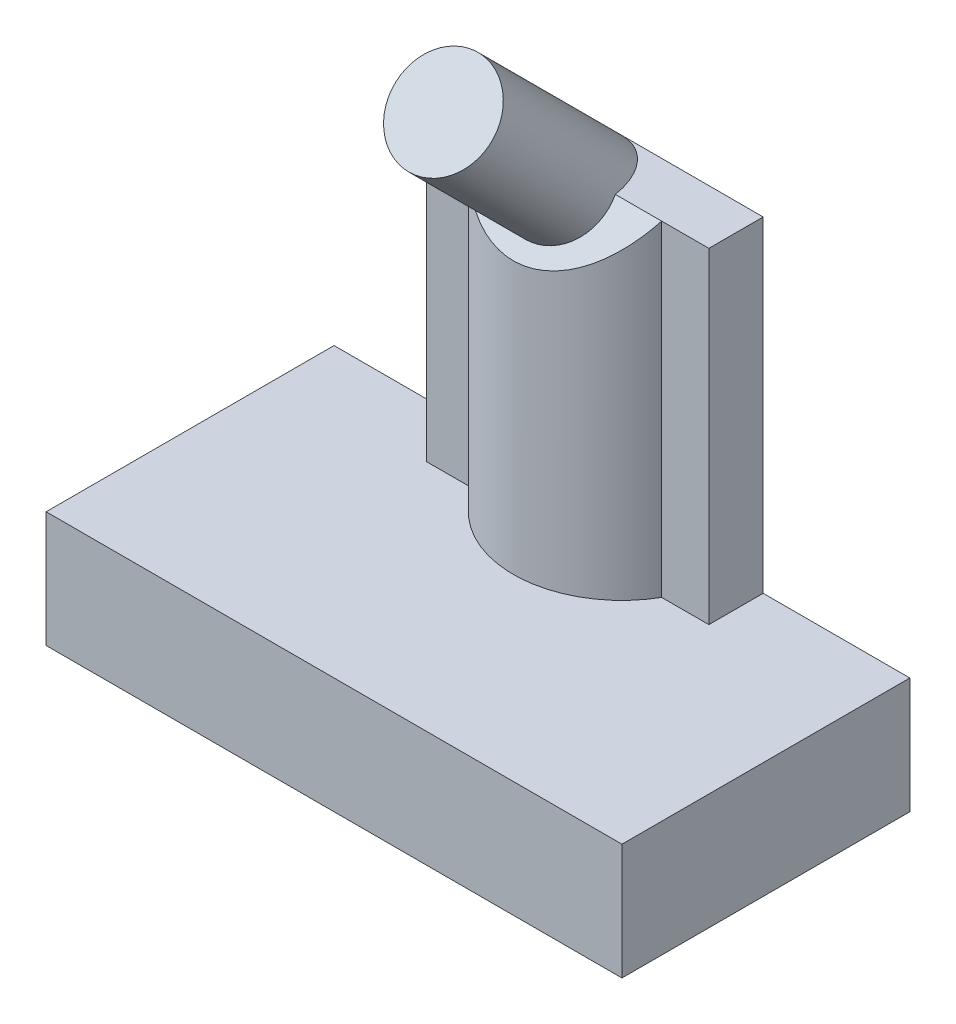
from build123d import *

# Parameters (mm, degrees)
SKETCH1_W           = 15.9
SKETCH1_H           = 7.95
BOSS_EXTRUDE1_DEPTH = 3.2
SHELL1_T            = -1.2
SKETCH3_R           = 1.525
SKETCH3_R_2         = 0.5
BOSS_EXTRUDE3_DEPTH = 2
BOSS_EXTRUDE4_DEPTH = 9
SKETCH7_W           = 30
SKETCH7_H           = 30
CUT_EXTRUDE1_DEPTH  = 14.969416324
BOSS_EXTRUDE5_START = -5.621499
SKETCH8_R           = 1.35
BOSS_EXTRUDE5_DEPTH = 5.621499


with BuildPart() as part:
    # Sketch1 → Boss-Extrude1 (new body)
    with BuildSketch(Plane(origin=(0, 0, 0), x_dir=(1, 0, 0), z_dir=(0, 1, 0))):
        Rectangle(SKETCH1_W, SKETCH1_H)
    extrude(amount=BOSS_EXTRUDE1_DEPTH)

    # Shell1
    shell1_openings = [part.faces().sort_by_distance(p)[0] for p in [
        (0, 0, 0),
    ]]
    offset(amount=SHELL1_T, openings=shell1_openings, kind=Kind.INTERSECTION)

    # Sketch3 → Boss-Extrude3 (add)
    with BuildSketch(Plane.XZ.offset(-2)):
        with Locations(Location((0, 0, 0), (0, 0, 270))):
            Circle(SKETCH3_R)
        with Locations(Location((0, 0, 0), (0, 0, 270))):
            Circle(SKETCH3_R_2, mode=Mode.SUBTRACT)
    extrude(amount=BOSS_EXTRUDE3_DEPTH)

    # Sketch4 → Boss-Extrude4 (add)
    with BuildSketch(Plane(origin=(0, 3.2, 0), x_dir=(1, 0, 0), z_dir=(0, 1, 0))):
        with BuildLine():
            Line((-3.9, 3.975), (-3.9, 2.475))
            Line((-3.9, 2.475), (-2.598076211, 2.475))
            ThreePointArc((-2.598076211, 2.475), (0, 0.975), (2.598076211, 2.475))
            Line((2.598076211, 2.475), (3.9, 2.475))
            Line((3.9, 2.475), (3.9, 3.975))
            Line((3.9, 3.975), (-3.9, 3.975))
        make_face()
    extrude(amount=BOSS_EXTRUDE4_DEPTH)

    # Sketch7 → Cut-Extrude1 (cut, through all)
    with BuildSketch(Plane(origin=(0, 4.863093078, 4.863093078), x_dir=(1, 0, 0), z_dir=(0, 0.7071067811865475, 0.7071067811865477))):
        Rectangle(SKETCH7_W, SKETCH7_H)
    extrude(amount=CUT_EXTRUDE1_DEPTH, mode=Mode.SUBTRACT)

    # Sketch8 → Boss-Extrude5 (add)
    with BuildSketch(Plane(origin=(0, 8.0875, 8.0875), x_dir=(1, 0, 0), z_dir=(0, 0.7071067811865475, 0.7071067811865477)).offset(BOSS_EXTRUDE5_START)):
        with Locations(Location((0, 10.087452186, 0), (0, 0, 270))):
            Circle(SKETCH8_R)
    extrude(amount=BOSS_EXTRUDE5_DEPTH)


solid = part.part
